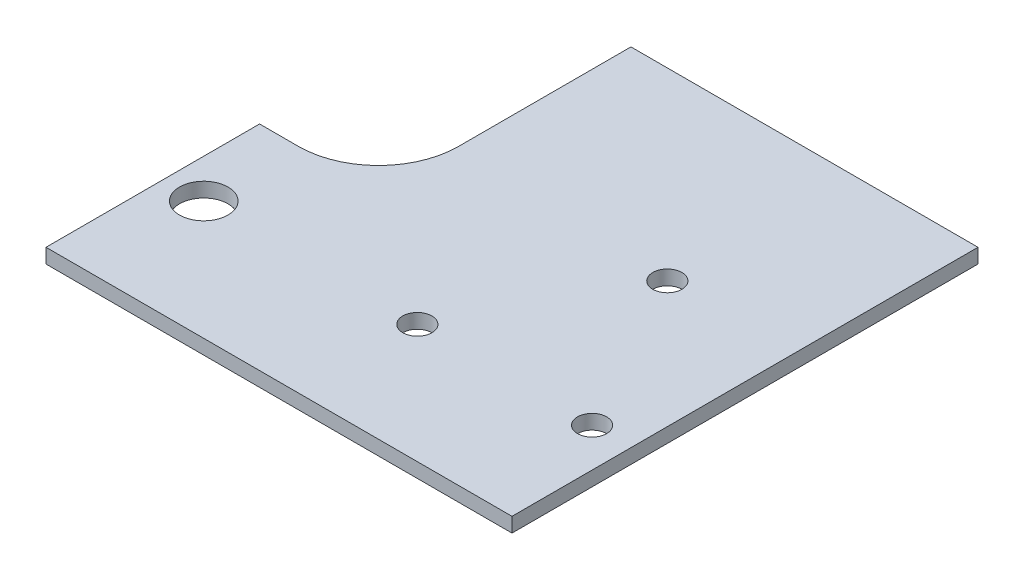
from build123d import *

# Parameters (mm, degrees)
SKETCH1_W           = 609.6
SKETCH1_H           = 609.6
BOSS_EXTRUDE1_DEPTH = 19.05
SKETCH2_R           = 31.75
CUT_EXTRUDE1_DEPTH  = 432.473037976
SKETCH9_R           = 104.775
CUT_EXTRUDE8_DEPTH  = 432.473037976
CUT_EXTRUDE9_DEPTH  = 432.473037976
SKETCH11_W          = 123.071998818
SKETCH11_H          = 104.775
CUT_EXTRUDE10_DEPTH = 432.473037976
SKETCH12_R          = 19.05
CUT_EXTRUDE11_DEPTH = 432.473037976
SKETCH13_R          = 19.05
CUT_EXTRUDE12_DEPTH = 432.473037976


with BuildPart() as part:
    # Sketch1 → Boss-Extrude1 (new body)
    with BuildSketch(Plane(origin=(0, 0, 0), x_dir=(1, 0, 0), z_dir=(0, 1, 0))):
        Rectangle(SKETCH1_W, SKETCH1_H)
    extrude(amount=BOSS_EXTRUDE1_DEPTH)

    # Sketch2 → Cut-Extrude1 (cut, through all)
    with BuildSketch(Plane.XZ):
        with Locations(Location((-254, 149.225, 0), (0, 0, 270))):
            Circle(SKETCH2_R)
    extrude(amount=-CUT_EXTRUDE1_DEPTH, mode=Mode.SUBTRACT)

    # Sketch9 → Cut-Extrude8 (cut, through all)
    with BuildSketch(Plane.XZ):
        with Locations((-254, -79.375)):
            Circle(SKETCH9_R)
    extrude(amount=-CUT_EXTRUDE8_DEPTH, mode=Mode.SUBTRACT)

    # Sketch10 → Cut-Extrude9 (cut, through all)
    with BuildSketch(Plane.XZ):
        Polygon((-254, -79.375), (-149.225, -79.375), (-149.225, -304.8), (-304.8, -304.8), (-304.8, -79.375), align=None)
    extrude(amount=-CUT_EXTRUDE9_DEPTH, mode=Mode.SUBTRACT)

    # Sketch11 → Cut-Extrude10 (cut, through all)
    with BuildSketch(Plane.XZ):
        with Locations((-315.535999409, -26.9875)):
            Rectangle(SKETCH11_W, SKETCH11_H)
    extrude(amount=-CUT_EXTRUDE10_DEPTH, mode=Mode.SUBTRACT)

    # Sketch12 → Cut-Extrude11 (cut, through all)
    with BuildSketch(Plane.XZ):
        with Locations(Location((25.4, 149.225, 0), (0, 0, 270))):
            Circle(SKETCH12_R)
        with Locations(Location((254, 149.225, 0), (0, 0, 270))):
            Circle(SKETCH12_R)
    extrude(amount=-CUT_EXTRUDE11_DEPTH, mode=Mode.SUBTRACT)

    # Sketch13 → Cut-Extrude12 (cut, through all)
    with BuildSketch(Plane.XZ):
        with Locations(Location((139.7, -63.5, 0), (0, 0, 270))):
            Circle(SKETCH13_R)
    extrude(amount=-CUT_EXTRUDE12_DEPTH, mode=Mode.SUBTRACT)


solid = part.part
